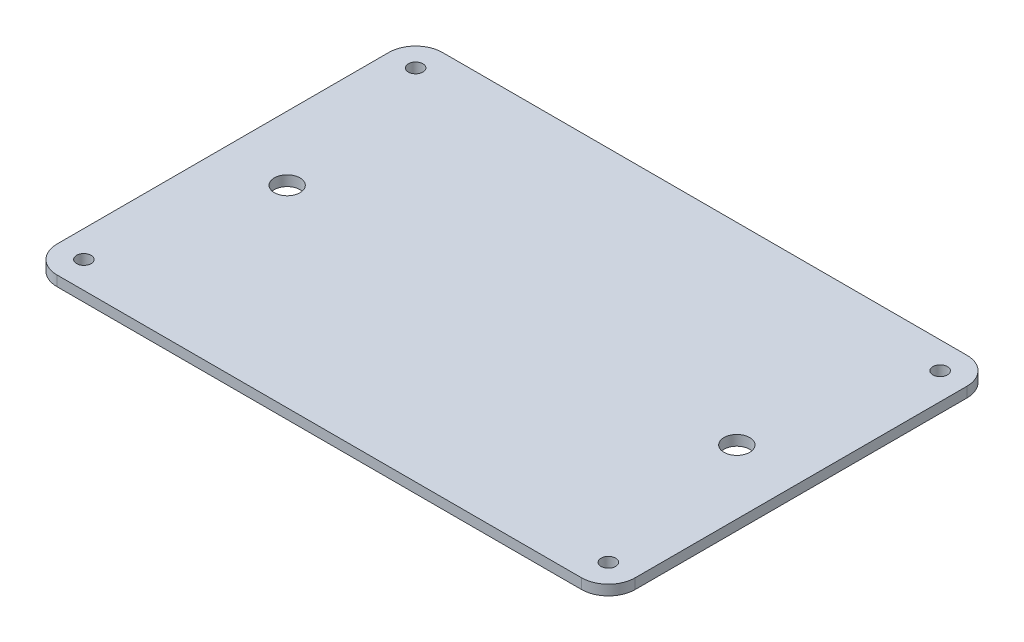
from build123d import *

# Parameters (mm, degrees)
SKETCH2_R           = 1.1303
BOSS_EXTRUDE3_DEPTH = 1.59
SKETCH3_R           = 2
CUT_EXTRUDE1_DEPTH  = 1.59


with BuildPart() as part:
    # Sketch2 → Boss-Extrude3 (new body)
    with BuildSketch(Plane(origin=(0, 0, 0), x_dir=(1, 0, 0), z_dir=(0, 1, 0))):
        with BuildLine():
            Line((-45, 25.825), (-45, -25.825))
            ThreePointArc((-45, -25.825), (-43.777170811, -28.777170811), (-40.825, -30))
            Line((-40.825, -30), (40.825, -30))
            ThreePointArc((40.825, -30), (43.777170811, -28.777170811), (45, -25.825))
            Line((45, -25.825), (45, 25.825))
            ThreePointArc((45, 25.825), (43.777170811, 28.777170811), (40.825, 30))
            Line((40.825, 30), (-40.825, 30))
            ThreePointArc((-40.825, 30), (-43.777170811, 28.777170811), (-45, 25.825))
        make_face()
        with Locations(Location((40.825, 25.825, 0), (0, 0, 90))):
            Circle(SKETCH2_R, mode=Mode.SUBTRACT)
        with Locations(Location((-40.825, 25.825, 0), (0, 0, 90))):
            Circle(SKETCH2_R, mode=Mode.SUBTRACT)
        with Locations(Location((-40.825, -25.825, 0), (0, 0, 90))):
            Circle(SKETCH2_R, mode=Mode.SUBTRACT)
        with Locations(Location((40.825, -25.825, 0), (0, 0, 90))):
            Circle(SKETCH2_R, mode=Mode.SUBTRACT)
    extrude(amount=BOSS_EXTRUDE3_DEPTH)

    # Sketch3 → Cut-Extrude1 (cut)
    with BuildSketch(Plane.XZ):
        with Locations(Location((-35, 0, 0), (0, 0, 270))):
            Circle(SKETCH3_R)
        with Locations(Location((35, 0, 0), (0, 0, 270))):
            Circle(SKETCH3_R)
    extrude(amount=-CUT_EXTRUDE1_DEPTH, mode=Mode.SUBTRACT)


solid = part.part
